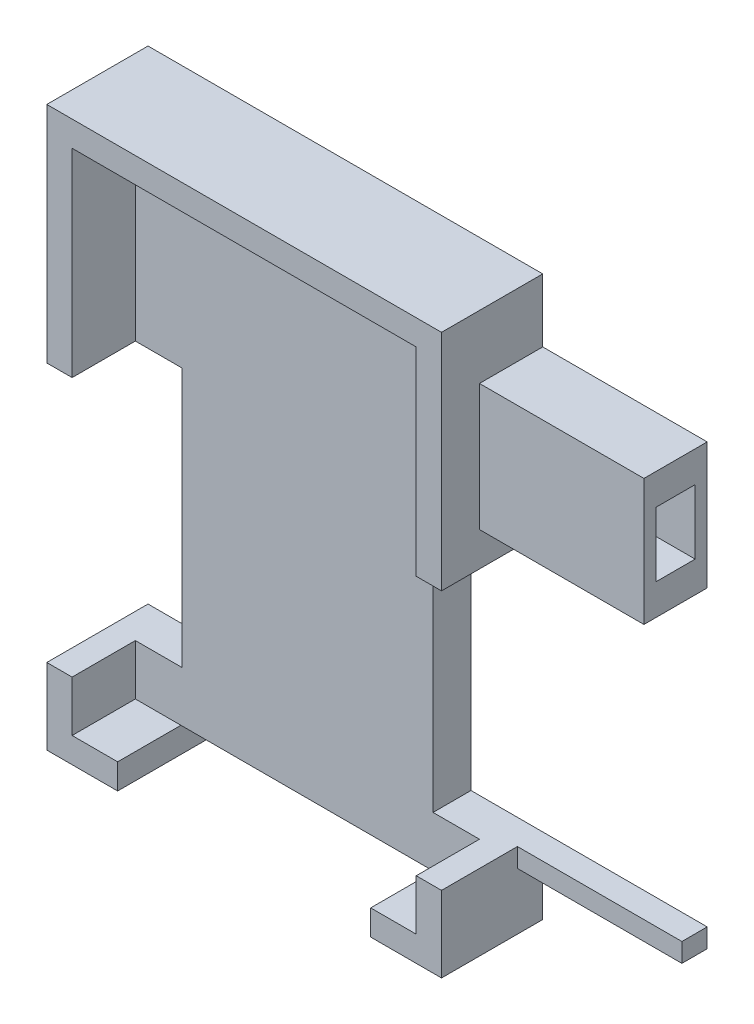
from build123d import *

# Parameters (mm, degrees)
BOSS_EXTRUDE1_DEPTH = 3
BOSS_EXTRUDE2_DEPTH = 5
SKETCH1_4_W         = 13
SKETCH1_4_H         = 10
BOSS_EXTRUDE3_DEPTH = 5
SKETCH2_W           = 3.1
SKETCH2_H           = 5.1
CUT_EXTRUDE1_DEPTH  = 6
BOSS_EXTRUDE4_DEPTH = 8
SKETCH3_W           = 13
SKETCH3_H           = 1.5
BOSS_EXTRUDE5_DEPTH = 2


with BuildPart() as part:
    # Sketch1 → Boss-Extrude1 (new body)
    with BuildSketch(Plane.XY):
        Polygon((9.93, 4.4), (13.6, 4.4), (13.6, 20.1), (-13.6, 20.1), (-13.6, 4.4), (-9.93, 4.4), (-9.93, -16.1), (-13.6, -16.1), (-13.6, -20.1), (-10, -20.1), (10, -20.1), (13.6, -20.1), (13.6, -16.1), (9.93, -16.1), align=None)
    extrude(amount=BOSS_EXTRUDE1_DEPTH)

    # Sketch1<3> → Boss-Extrude2 (add)
    with BuildSketch(Plane.XY):
        Polygon((15.6, 4.4), (15.6, 22.1), (-15.6, 22.1), (-15.6, 4.4), (-13.6, 4.4), (-13.6, 20.1), (13.6, 20.1), (13.6, 4.4), align=None)
        Polygon((15.6, -22.1), (15.6, -16.1), (13.6, -16.1), (13.6, -20.1), (10, -20.1), (10, -22.1), align=None)
        Polygon((-13.6, -16.1), (-15.6, -16.1), (-15.6, -22.1), (-10, -22.1), (-10, -20.1), (-13.6, -20.1), align=None)
    extrude(amount=BOSS_EXTRUDE2_DEPTH)

    # Sketch1<4> → Boss-Extrude3 (add)
    with BuildSketch(Plane.XY):
        with Locations((22.1, 12.1)):
            Rectangle(SKETCH1_4_W, SKETCH1_4_H)
    extrude(amount=BOSS_EXTRUDE3_DEPTH)

    # Sketch2 → Cut-Extrude1 (cut)
    with BuildSketch(Plane(origin=(28.6, 0, 0), x_dir=(0, 0, -1), z_dir=(1, 0, 0))):
        with Locations((-2.5, 12.1)):
            Rectangle(SKETCH2_W, SKETCH2_H)
    extrude(amount=-CUT_EXTRUDE1_DEPTH, mode=Mode.SUBTRACT)

    # Sketch1<5> → Boss-Extrude4 (add)
    with BuildSketch(Plane.XY):
        Polygon((15.6, 4.4), (15.6, 22.1), (-15.6, 22.1), (-15.6, 4.4), (-13.6, 4.4), (-13.6, 20.1), (13.6, 20.1), (13.6, 4.4), align=None)
        Polygon((15.6, -22.1), (15.6, -16.1), (13.6, -16.1), (13.6, -20.1), (10, -20.1), (10, -22.1), align=None)
        Polygon((-13.6, -16.1), (-15.6, -16.1), (-15.6, -22.1), (-10, -22.1), (-10, -20.1), (-13.6, -20.1), align=None)
    extrude(amount=BOSS_EXTRUDE4_DEPTH)

    # Sketch3 → Boss-Extrude5 (add)
    with BuildSketch(Plane(origin=(0, 0, 0), x_dir=(-1, 0, 0), z_dir=(0, 0, -1))):
        with Locations((-22.1, -16.85)):
            Rectangle(SKETCH3_W, SKETCH3_H)
    extrude(amount=-BOSS_EXTRUDE5_DEPTH)


solid = part.part
